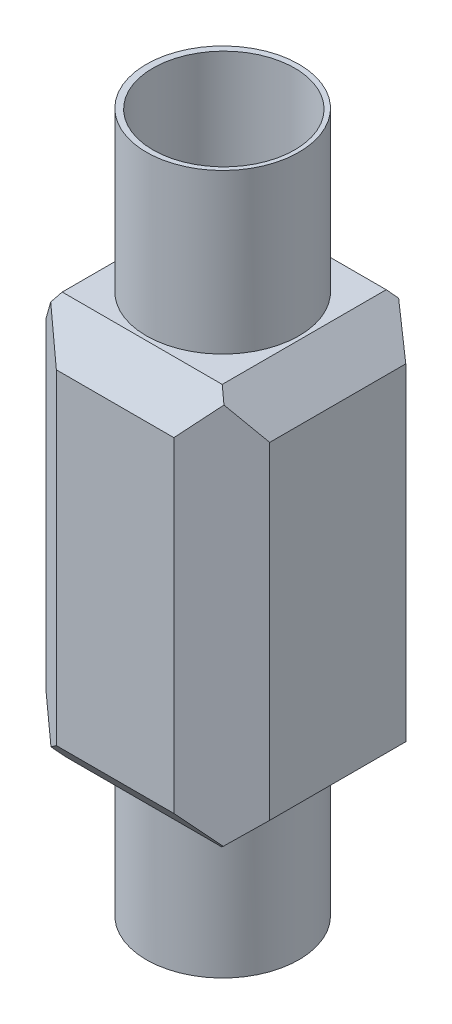
from build123d import *

# Parameters (mm, degrees)
SKETCH1_W           = 100
SKETCH1_H           = 100
BOSS_EXTRUDE1_DEPTH = 180
SKETCH2_R           = 34.257790197
BOSS_EXTRUDE2_DEPTH = 350
SKETCH3_W           = 152.006357392
SKETCH3_H           = 282.452416457
CUT_EXTRUDE2_DEPTH  = 400
CUT_EXTRUDE3_DEPTH  = 400
CUT_EXTRUDE4_DEPTH  = 400
CUT_EXTRUDE5_DEPTH  = 400
SKETCH7_W           = 160.159381639
SKETCH7_H           = 147.362276113
CUT_EXTRUDE6_DEPTH  = 400
SKETCH8_W           = 147.310744502
SKETCH8_H           = 162.038906966
CUT_EXTRUDE7_DEPTH  = 400
SKETCH9_R           = 31.847293423
CUT_EXTRUDE8_DEPTH  = 400


with BuildPart() as part:
    # Sketch1 → Boss-Extrude1 (new body)
    with BuildSketch(Plane(origin=(0, 0, 0), x_dir=(1, 0, 0), z_dir=(0, 1, 0))):
        with Locations((-50, 50)):
            Rectangle(SKETCH1_W, SKETCH1_H)
    extrude(amount=BOSS_EXTRUDE1_DEPTH)

    # Sketch2 → Boss-Extrude2 (add, symmetric)
    with BuildSketch(Plane(origin=(0, 180, 0), x_dir=(1, 0, 0), z_dir=(0, 1, 0))):
        with Locations(Location((-51.377291833, 49.076536384, 0), (0, 0, 270))):
            Circle(SKETCH2_R)
    extrude(amount=BOSS_EXTRUDE2_DEPTH, both=True)

    # Sketch3 → Cut-Extrude2 (cut)
    with BuildSketch(Plane(origin=(0, 0, 0), x_dir=(0, 0, -1), z_dir=(1, 0, 0))):
        with Locations((57.419900112, 502.274302507)):
            Rectangle(SKETCH3_W, SKETCH3_H)
    extrude(amount=-CUT_EXTRUDE2_DEPTH, mode=Mode.SUBTRACT)

    # Sketch4 → Cut-Extrude3 (cut)
    with BuildSketch(Plane(origin=(0, 0, 0), x_dir=(0, 0, -1), z_dir=(1, 0, 0))):
        Polygon((12.981970869, 0), (-8.994244796, 25.828096003), (-18.564506014, -15.259465835), align=None)
        Polygon((85.072517936, -1.448103984), (109.237639161, 19.113145112), (115.920034239, -3.267382694), align=None)
        Polygon((12.981970869, 180), (-8.994244796, 148.537596011), (-15.418178585, 193.219274892), align=None)
        Polygon((85.072517936, 181.854312784), (103.841225373, 159.795920888), (106.132549481, 198.647393934), align=None)
    extrude(amount=-CUT_EXTRUDE3_DEPTH, mode=Mode.SUBTRACT)

    # Sketch5 → Cut-Extrude4 (cut)
    with BuildSketch(Plane.XY):
        Polygon((-85.623287335, 0), (-106.370377984, 21.426392531), (-122.288861874, 3.209259887), (-93.526345261, -19.884701759), align=None)
        Polygon((-15.694988751, 0), (0, 15.257385304), (12.122677088, 15.257385304), (10.563067769, -19.884701759), align=None)
        Polygon((-87.166490339, 180.248071029), (-106.370377984, 151.29108453), (-117.705469457, 200.501115102), align=None)
        Polygon((-15.694988751, 180.248071029), (7.833767065, 153.279557508), (0, 193.941208308), align=None)
    extrude(amount=-CUT_EXTRUDE4_DEPTH, mode=Mode.SUBTRACT)

    # Sketch6 → Cut-Extrude5 (cut)
    with BuildSketch(Plane(origin=(0, 180, 0), x_dir=(1, 0, 0), z_dir=(0, 1, 0))):
        Polygon((-112.386997555, 28.400400964), (-64.261264503, -10.212759359), (-84.406366528, -15.51192827), (-124.649689542, -15.51192827), align=None)
        Polygon((-97.065537028, 135.861756084), (-119.37552445, 77.792688888), (-118.043343626, 64.347606737), (-66.428694172, 110.575168787), align=None)
        Polygon((-24.69640689, -21.815840769), (11.092108798, -8.97361337), (17.428316417, 32.393768119), (-38.531576846, -11.139157378), align=None)
        Polygon((-17.445484601, 140.804394854), (35.417473102, 107.262520599), (9.305452855, 72.996438725), (-31.724385352, 103.625272537), align=None)
    extrude(amount=-CUT_EXTRUDE5_DEPTH, mode=Mode.SUBTRACT)

    # Sketch7 → Cut-Extrude6 (cut)
    with BuildSketch(Plane.XY):
        with Locations((-66.123258915, -136.36252694)):
            Rectangle(SKETCH7_W, SKETCH7_H)
    extrude(amount=-CUT_EXTRUDE6_DEPTH, mode=Mode.SUBTRACT)

    # Sketch8 → Cut-Extrude7 (cut)
    with BuildSketch(Plane.XY):
        with Locations((-53.541153336, 332.448287589)):
            Rectangle(SKETCH8_W, SKETCH8_H)
    extrude(amount=-CUT_EXTRUDE7_DEPTH, mode=Mode.SUBTRACT)

    # Sketch9 → Cut-Extrude8 (cut)
    with BuildSketch(Plane(origin=(0, 251.428834106, 0), x_dir=(1, 0, 0), z_dir=(0, 1, 0))):
        with Locations(Location((-50.808993157, 49.032036374, 0), (0, 0, 270))):
            Circle(SKETCH9_R)
    extrude(amount=-CUT_EXTRUDE8_DEPTH, mode=Mode.SUBTRACT)


solid = part.part
